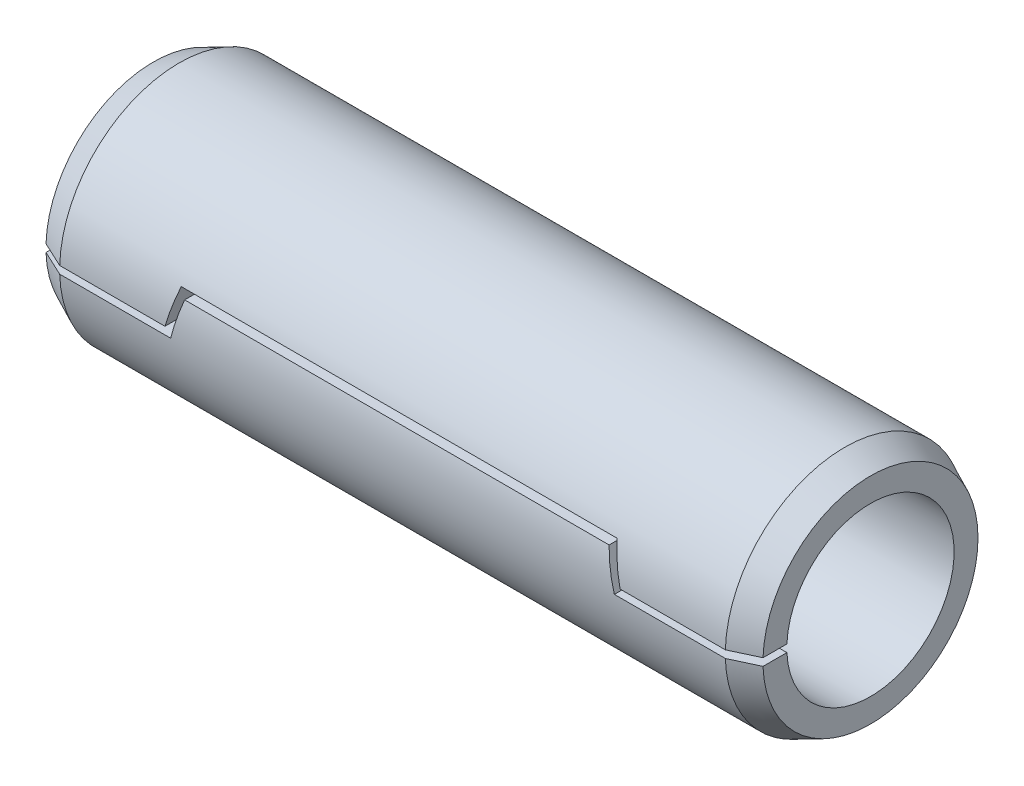
from build123d import *

# Parameters (mm, degrees)
CUT_EXTRUDE_THIN1_DEPTH = 14.266499161


with BuildPart() as part:
    # Sketch1 → Revolve1 (revolve)
    with BuildSketch(Plane.XY, mode=Mode.PRIVATE) as revolve1_sk:
        Polygon((-12, 2.8), (12, 2.8), (12, 3.5992), (11.140481626, 4), (-11.140481626, 4), (-12, 3.5992), align=None)
    revolve(revolve1_sk.sketch.rotate(Axis((-12, 0, 0), (1, 0, 0)), 90), axis=Axis((-12, 0, 0), (1, 0, 0)))

    # Sketch2 → Cut-Extrude-Thin1 (cut, through all)
    with BuildSketch(Plane.XY):
        Polygon((-12, -0.125), (-7.425623157, -0.125), (-7.104084127, 1.075), (7.104084127, 1.075), (7.425623157, -0.125), (12, -0.125), (12, 0.125), (7.617454904, 0.125), (7.295915873, 1.325), (-7.295915873, 1.325), (-7.617454904, 0.125), (-12, 0.125), align=None)
    extrude(amount=CUT_EXTRUDE_THIN1_DEPTH, mode=Mode.SUBTRACT)


solid = part.part
